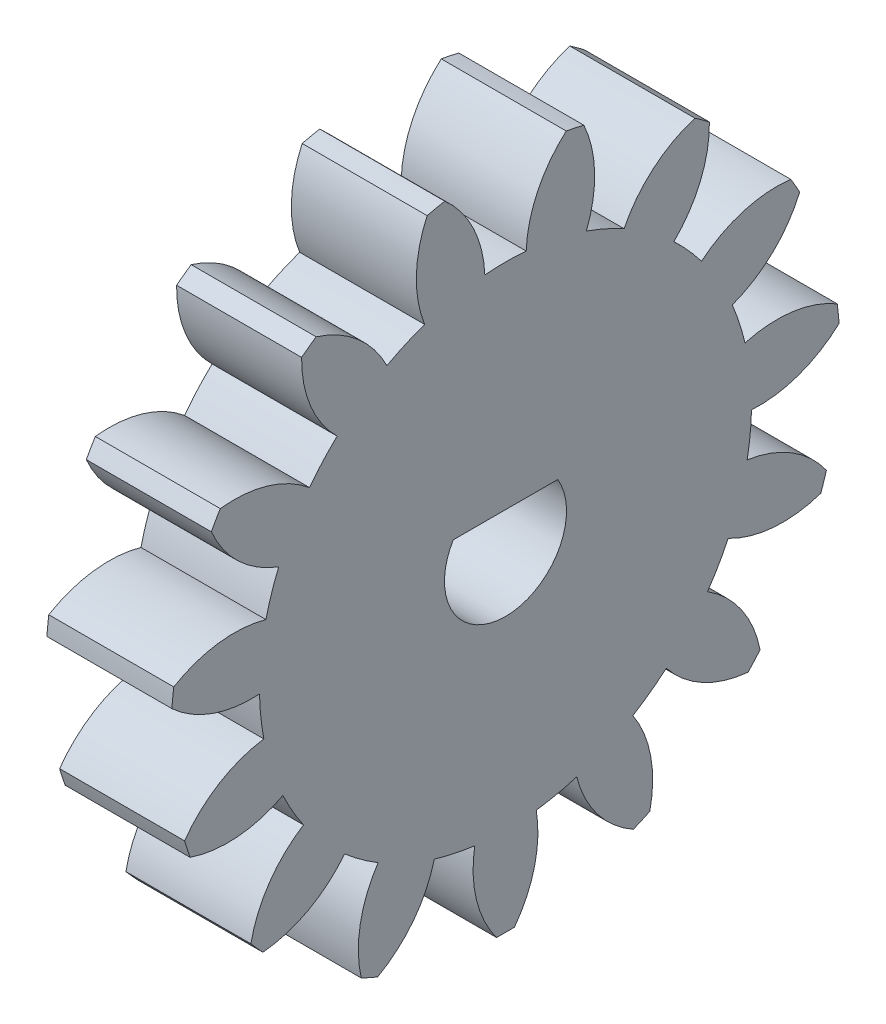
from build123d import *

# Parameters (mm, degrees)
BASPROSKE_W        = 6.35
BASPROSKE_H        = 17
TOOTHCUT_DEPTH     = 25.86609137
TEETHCUTS_COUNT    = 15
TEETHCUTS_ANGLE    = 336
BORSKE_R           = 0.4
BORE_DEPTH         = 50.0000508
CUT_EXTRUDE1_DEPTH = 10


with BuildPart() as part:
    # BasProSke → Base-Revolve (revolve)
    with BuildSketch(Plane(origin=(0, 0, 0), x_dir=(1, 0, 0), z_dir=(0, 1, 0)), mode=Mode.PRIVATE) as base_revolve_sk:
        with Locations((3.175, 8.5)):
            Rectangle(BASPROSKE_W, BASPROSKE_H)
    revolve(base_revolve_sk.sketch.rotate(Axis((-10, 0, 0), (1, 0, 0)), 180), axis=Axis((-10, 0, 0), (1, 0, 0)))

    # TooCutSke → ToothCut (cut, through all)
    with BuildSketch(Plane(origin=(0, 0, 0), x_dir=(0, 0, -1), z_dir=(1, 0, 0))):
        with BuildLine():
            ThreePointArc((1.050056448, 12.454813626), (0, 12.499), (-1.050056448, 12.454813626))
            ThreePointArc((-1.050056448, 12.454813626), (-1.638118106, 14.809604533), (-3.110934279, 16.73876737))
            ThreePointArc((-3.110934279, 16.73876737), (0, 17.0254), (3.110934279, 16.73876737))
            ThreePointArc((3.110934279, 16.73876737), (1.638118106, 14.809604533), (1.050056448, 12.454813626))
        make_face()
    toothcut = extrude(amount=TOOTHCUT_DEPTH, mode=Mode.SUBTRACT)

    # TeethCuts: ToothCut ×15 about axis
    teethcuts_axis = Axis((-10, 0, 0), (1, 0, 0))
    for i in range(1, TEETHCUTS_COUNT):
        add(toothcut.rotate(teethcuts_axis, i * TEETHCUTS_ANGLE / (TEETHCUTS_COUNT - 1)), mode=Mode.SUBTRACT)

    # BorSke → Bore (cut, symmetric)
    with BuildSketch(Plane(origin=(0, 0, 0), x_dir=(0, 0, -1), z_dir=(1, 0, 0))):
        with Locations(Location((0, 0, 0), (0, 0, 180))):
            Circle(BORSKE_R)
    extrude(amount=BORE_DEPTH, both=True, mode=Mode.SUBTRACT)

    # Sketch1 → Cut-Extrude1 (cut)
    with BuildSketch(Plane(origin=(6.35, 0, 0), x_dir=(0, 0, -1), z_dir=(1, 0, 0))):
        with BuildLine():
            Line((2.655183609, 1.6), (-2.655183609, 1.6))
            ThreePointArc((-2.655183609, 1.6), (-0.830340536, -2.986726401), (3.1, 0))
            ThreePointArc((3.1, 0), (2.986726401, 0.830340536), (2.655183609, 1.6))
        make_face()
    extrude(amount=-CUT_EXTRUDE1_DEPTH, mode=Mode.SUBTRACT)


solid = part.part
